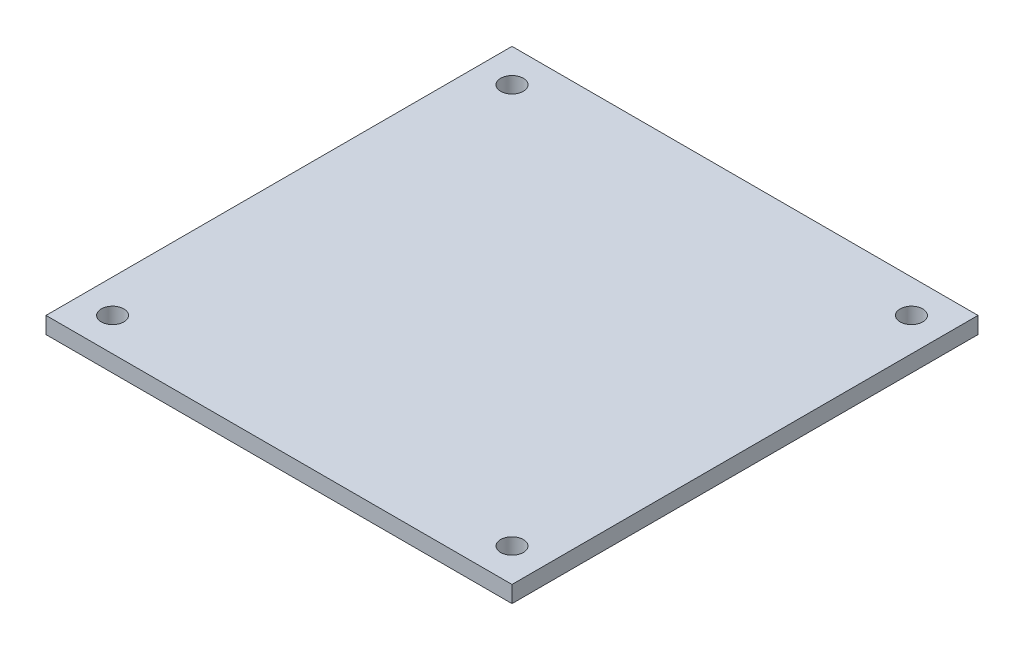
from build123d import *

# Parameters (mm, degrees)
SKETCH1_W   = 70
SKETCH1_H   = 70
SKETCH1_R   = 1.7
PLATE_DEPTH = 2.5


with BuildPart() as part:
    # Sketch1 → Plate (new body)
    with BuildSketch(Plane(origin=(0, 0, 0), x_dir=(1, 0, 0), z_dir=(0, 1, 0))):
        with Locations((35, 35)):
            Rectangle(SKETCH1_W, SKETCH1_H)
        with Locations(Location((65, 65, 0), (0, 0, 270))):
            Circle(SKETCH1_R, mode=Mode.SUBTRACT)
        with Locations(Location((5, 65, 0), (0, 0, 90))):
            Circle(SKETCH1_R, mode=Mode.SUBTRACT)
        with Locations(Location((65, 5, 0), (0, 0, 90))):
            Circle(SKETCH1_R, mode=Mode.SUBTRACT)
        with Locations(Location((5, 5, 0), (0, 0, 270))):
            Circle(SKETCH1_R, mode=Mode.SUBTRACT)
    extrude(amount=PLATE_DEPTH)


solid = part.part
